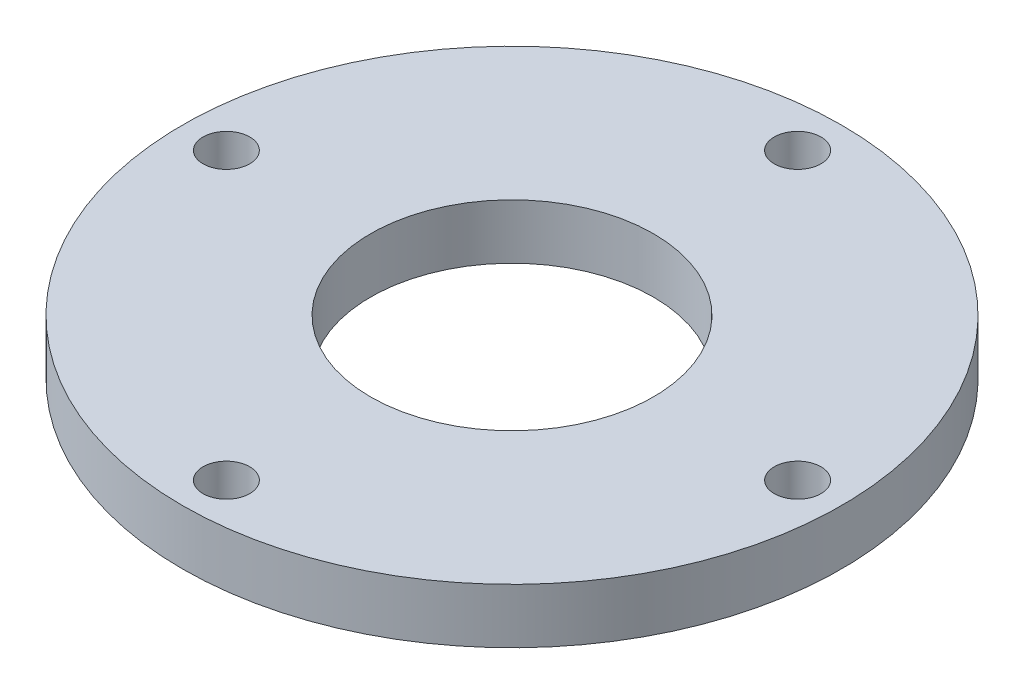
from build123d import *

# Parameters (mm, degrees)
SKETCH1_R           = 24
SKETCH1_R_2         = 10.3
BOSS_EXTRUDE1_DEPTH = 4
SKETCH3_R           = 1.7
CUT_EXTRUDE1_DEPTH  = 35.176014981


with BuildPart() as part:
    # Sketch1 → Boss-Extrude1 (new body)
    with BuildSketch(Plane(origin=(0, 0, 0), x_dir=(1, 0, 0), z_dir=(0, 1, 0))):
        with Locations(Location((0, 0, 0), (0, 0, 270))):
            Circle(SKETCH1_R)
        with Locations(Location((0, 0, 0), (0, 0, 270))):
            Circle(SKETCH1_R_2, mode=Mode.SUBTRACT)
    extrude(amount=BOSS_EXTRUDE1_DEPTH)

    # Sketch3 → Cut-Extrude1 (cut, through all)
    with BuildSketch(Plane(origin=(0, 4, 0), x_dir=(1, 0, 0), z_dir=(0, 1, 0))):
        with Locations(Location((-20.8, 0, 0), (0, 0, 270))):
            Circle(SKETCH3_R)
        with Locations(Location((0, 20.8, 0), (0, 0, 270))):
            Circle(SKETCH3_R)
        with Locations(Location((20.8, 0, 0), (0, 0, 270))):
            Circle(SKETCH3_R)
        with Locations(Location((0, -20.8, 0), (0, 0, 270))):
            Circle(SKETCH3_R)
    extrude(amount=-CUT_EXTRUDE1_DEPTH, mode=Mode.SUBTRACT)


solid = part.part
